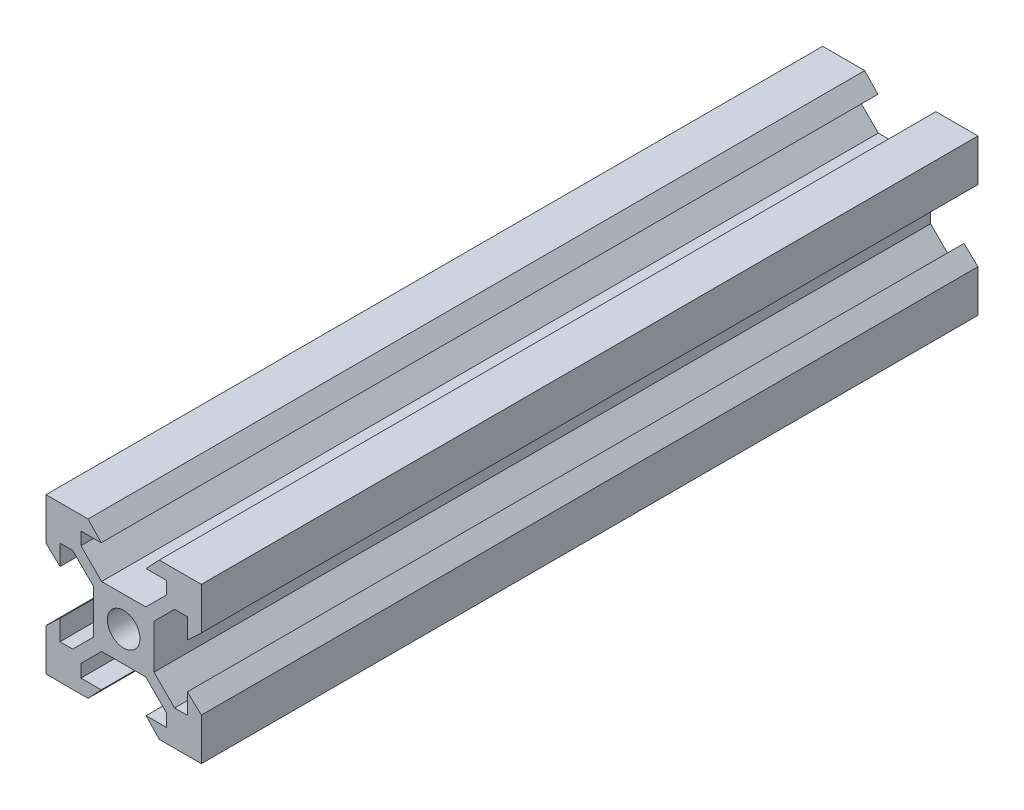
from build123d import *

# Parameters (mm, degrees)
SKETCH1_R           = 2.1
BOSS_EXTRUDE1_DEPTH = 100


with BuildPart() as part:
    # Sketch1 → Boss-Extrude1 (new body)
    with BuildSketch(Plane.XY):
        Polygon((-4.58, 10), (-2.885, 8.2), (-5.5, 8.2), (-5.5, 6.560660172), (-2.839339828, 3.9), (2.839339828, 3.9), (5.5, 6.560660172), (5.5, 8.2), (2.885, 8.2), (4.58, 10), (10, 10), (10, 4.58), (8.2, 2.885), (8.2, 5.5), (6.560660172, 5.5), (3.9, 2.839339828), (3.9, -2.839339828), (6.560660172, -5.5), (8.2, -5.5), (8.2, -2.885), (10, -4.58), (10, -10), (4.58, -10), (2.885, -8.2), (5.5, -8.2), (5.5, -6.560660172), (2.839339828, -3.9), (-2.839339828, -3.9), (-5.5, -6.560660172), (-5.5, -8.2), (-2.885, -8.2), (-4.58, -10), (-10, -10), (-10, -4.58), (-8.2, -2.885), (-8.2, -5.5), (-6.560660172, -5.5), (-3.9, -2.839339828), (-3.9, 2.839339828), (-6.560660172, 5.5), (-8.2, 5.5), (-8.2, 2.885), (-10, 4.58), (-10, 10), align=None)
        Circle(SKETCH1_R, mode=Mode.SUBTRACT)
    extrude(amount=BOSS_EXTRUDE1_DEPTH)


solid = part.part
